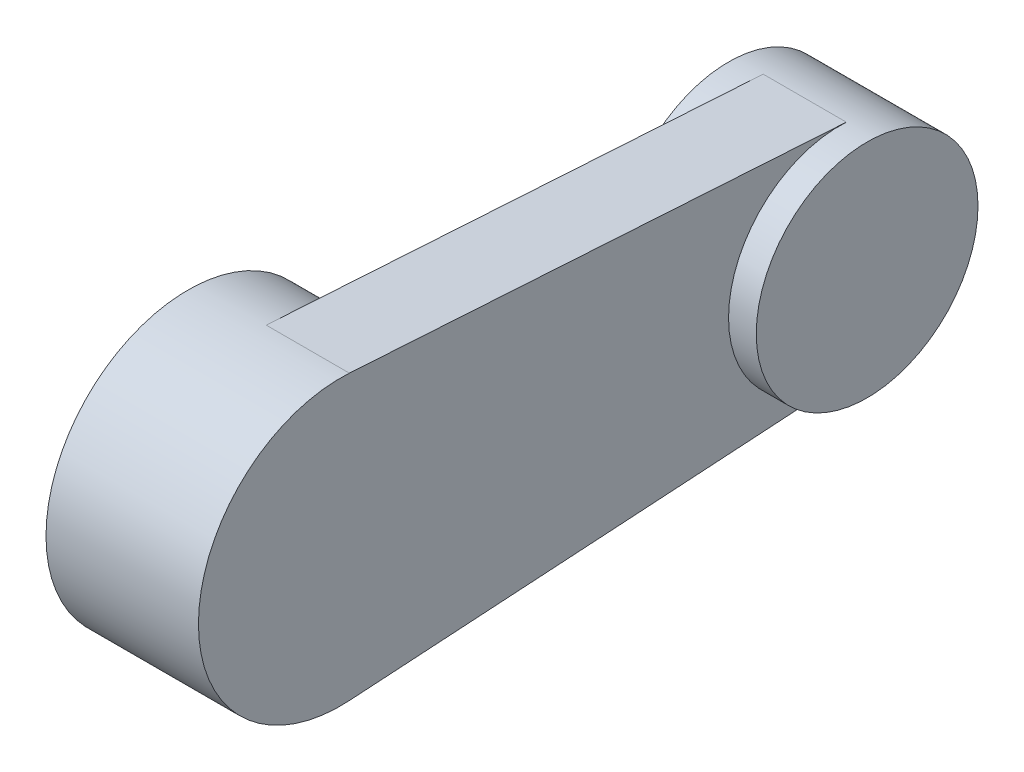
from build123d import *
from build123d.topology import SkipClean

# Parameters (mm, degrees)
BOSS_EXTRUDE2_DEPTH      = 60
BOSS_EXTRUDE4_START      = 50
SKETCH5_R                = 102.5
BOSS_EXTRUDE4_DEPTH      = 50
BOSS_EXTRUDE7_DEPTH      = 20
BOSS_EXTRUDE7_DEPTH_BACK = 80
SKETCH6_R                = 80


with BuildPart() as part:
    # Sketch2 → Boss-Extrude2 (new body)
    with BuildSketch(Plane(origin=(0, 0, 0), x_dir=(0, 0, -1), z_dir=(1, 0, 0))):
        with BuildLine():
            Line((6.40625, 102.299608801), (365, 79.843597113))
            ThreePointArc((365, 79.843597113), (440, 0), (365, -79.843597113))
            Line((365, -79.843597113), (6.40625, -102.299608801))
            ThreePointArc((6.40625, -102.299608801), (-102.5, 0), (6.40625, 102.299608801))
        make_face()
    extrude(amount=BOSS_EXTRUDE2_DEPTH)

    # Sketch5 → Boss-Extrude4 (add)
    with BuildSketch(Plane.ZY.offset(BOSS_EXTRUDE4_START)):
        Circle(SKETCH5_R)
    extrude(amount=-BOSS_EXTRUDE4_DEPTH)

    # Sketch6 → Boss-Extrude7 (add, two sides: drawn at the far end of the back side and taken through both)
    with SkipClean():  # the faces are left unmerged after this step: merging them gives an invalid solid
        with BuildSketch(Plane.ZY.offset(-BOSS_EXTRUDE7_DEPTH_BACK)):
            with Locations((-360, 0)):
                Circle(SKETCH6_R)
        extrude(amount=BOSS_EXTRUDE7_DEPTH + BOSS_EXTRUDE7_DEPTH_BACK)


solid = part.part
